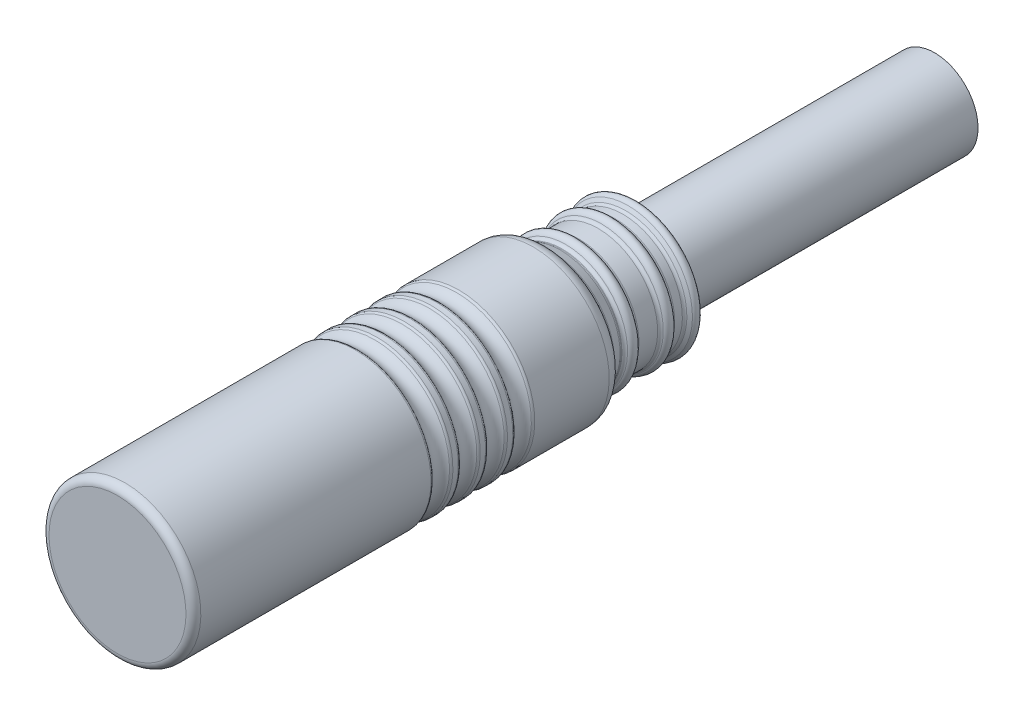
from build123d import *

# Parameters (mm, degrees)
SKETCH2_R           = 2.92
BOSS_EXTRUDE1_DEPTH = 20


with BuildPart() as part:
    # Sketch1 → Revolve1 (revolve)
    with BuildSketch(Plane(origin=(0, 0, 0), x_dir=(0, 0, -1), z_dir=(1, 0, 0))):
        with BuildLine():
            Line((0, 4.6), (0, 0))
            Line((0, 0), (34.9, 0))
            Line((34.9, 0), (34.9, 4.125))
            ThreePointArc((34.9, 4.125), (34.676177603, 4.433849628), (34.312996353, 4.317299477))
            Line((34.312996353, 4.317299477), (34.155032494, 4.102077325))
            ThreePointArc((34.155032494, 4.102077325), (34.066449917, 4.026974588), (33.953491227, 4))
            Line((33.953491227, 4), (33.43797693, 4))
            ThreePointArc((33.43797693, 4), (33.301046291, 4.040834993), (33.208848145, 4.15))
            ThreePointArc((33.208848145, 4.15), (32.865154968, 4.375), (32.521461791, 4.15))
            ThreePointArc((32.521461791, 4.15), (32.429263646, 4.040834993), (32.292333006, 4))
            Line((32.292333006, 4), (31.03797693, 4))
            ThreePointArc((31.03797693, 4), (30.901046291, 4.040834993), (30.808848145, 4.15))
            ThreePointArc((30.808848145, 4.15), (30.465154968, 4.375), (30.121461791, 4.15))
            ThreePointArc((30.121461791, 4.15), (30.029263646, 4.040834993), (29.892333006, 4))
            Line((29.892333006, 4), (29.842333006, 4))
            ThreePointArc((29.842333006, 4), (29.797026825, 4.004139572), (29.75322103, 4.0164212))
            Line((29.75322103, 4.0164212), (29.140968243, 4.25))
            ThreePointArc((29.140968243, 4.25), (28.999470537, 4.332738478), (28.892333006, 4.456790105))
            Line((28.892333006, 4.456790105), (28.792333006, 4.62073499))
            ThreePointArc((28.792333006, 4.62073499), (28.428137359, 4.971990536), (27.938614627, 5.1))
            Line((27.938614627, 5.1), (22.936545993, 5.1))
            ThreePointArc((22.936545993, 5.1), (22.850706486, 5.080642129), (22.781483679, 5.026315789))
            ThreePointArc((22.781483679, 5.026315789), (22.2, 4.75), (21.618516321, 5.026315789))
            ThreePointArc((21.618516321, 5.026315789), (21.549293514, 5.080642129), (21.463454007, 5.1))
            Line((21.463454007, 5.1), (21.10321266, 5.1))
            ThreePointArc((21.10321266, 5.1), (21.017373152, 5.080642129), (20.948150345, 5.026315789))
            ThreePointArc((20.948150345, 5.026315789), (20.366666667, 4.75), (19.785182988, 5.026315789))
            ThreePointArc((19.785182988, 5.026315789), (19.715960181, 5.080642129), (19.630120674, 5.1))
            Line((19.630120674, 5.1), (19.269879326, 5.1))
            ThreePointArc((19.269879326, 5.1), (19.184039819, 5.080642129), (19.114817012, 5.026315789))
            ThreePointArc((19.114817012, 5.026315789), (18.533333333, 4.75), (17.951849655, 5.026315789))
            ThreePointArc((17.951849655, 5.026315789), (17.882626848, 5.080642129), (17.79678734, 5.1))
            Line((17.79678734, 5.1), (17.436545993, 5.1))
            ThreePointArc((17.436545993, 5.1), (17.350706486, 5.080642129), (17.281483679, 5.026315789))
            ThreePointArc((17.281483679, 5.026315789), (16.7, 4.75), (16.118516321, 5.026315789))
            ThreePointArc((16.118516321, 5.026315789), (16.049293514, 5.080642129), (15.963454007, 5.1))
            Line((15.963454007, 5.1), (0.5, 5.1))
            ThreePointArc((0.5, 5.1), (0.146446609, 4.953553391), (0, 4.6))
        make_face()
    revolve(axis=Axis((0, 0, -34.9), (0, 0, 1)))

    # Sketch2 → Boss-Extrude1 (add)
    with BuildSketch(Plane(origin=(0, 0, -34.9), x_dir=(-1, 0, 0), z_dir=(0, 0, -1))):
        with Locations(Location((0, 0, 0), (0, 0, 270))):
            Circle(SKETCH2_R)
    extrude(amount=BOSS_EXTRUDE1_DEPTH)


solid = part.part
